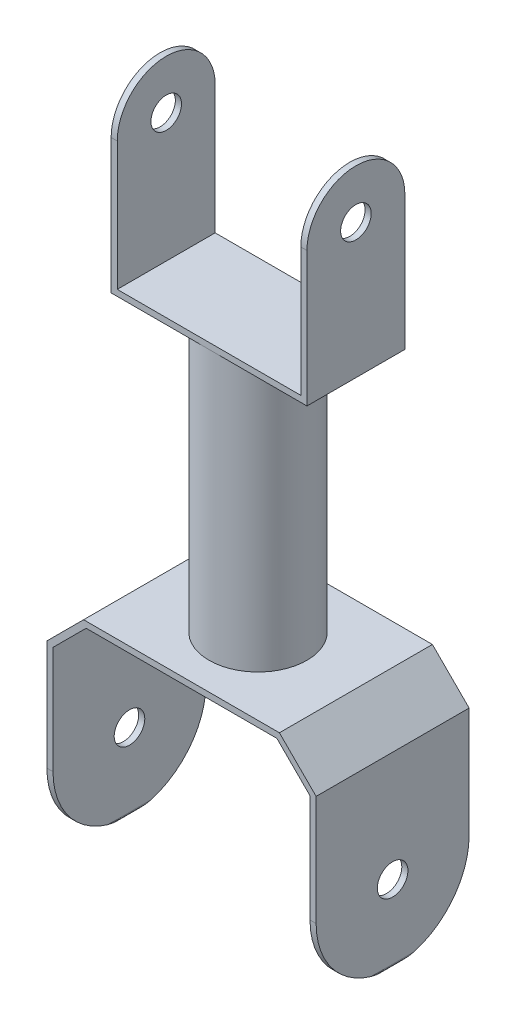
from build123d import *

# Parameters (mm, degrees)
BOSS_EXTRUDE1_DEPTH     = 12.5
BOSS_EXTRUDE1_2_DEPTH   = 12.5
CUT_EXTRUDE1_DEPTH      = 120.593059999
CUT_EXTRUDE1_DEPTH_BACK = 120.593059999
SKETCH3_R               = 2.5
SKETCH4_R               = 8
SKETCH4_R_2             = 6.000365116
BOSS_EXTRUDE2_DEPTH     = 44


with BuildPart() as part:
    # Sketch1 → Boss-Extrude1 (new, symmetric)
    with BuildSketch(Plane.XY):
        with BuildLine():
            Line((-16, 110), (-16, 80))
            Line((-16, 80), (16, 80))
            Line((16, 80), (16, 110))
            ThreePointArc((16, 110), (15.5, 110.5), (15, 110))
            Line((15, 110), (15, 81))
            Line((15, 81), (-15, 81))
            Line((-15, 81), (-15, 110))
            ThreePointArc((-15, 110), (-15.5, 110.5), (-16, 110))
        make_face()
    extrude(amount=BOSS_EXTRUDE1_DEPTH, both=True)


with BuildPart() as body_2:
    # Sketch1 → Boss-Extrude1 2 (new, symmetric)
    with BuildSketch(Plane.XY):
        with BuildLine():
            Line((-22, 0), (-22, 30))
            Line((-22, 30), (-16, 36))
            Line((-16, 36), (16, 36))
            Line((16, 36), (22, 30))
            Line((22, 30), (22, 0))
            ThreePointArc((22, 0), (21.5, -0.5), (21, 0))
            Line((21, 0), (21, 29.585786438))
            Line((21, 29.585786438), (15.585786438, 35))
            Line((15.585786438, 35), (-15.585786438, 35))
            Line((-15.585786438, 35), (-21, 29.585786438))
            Line((-21, 29.585786438), (-21, 0))
            ThreePointArc((-21, 0), (-21.5, -0.5), (-22, 0))
        make_face()
    extrude(amount=BOSS_EXTRUDE1_2_DEPTH, both=True)


with BuildPart() as cut_extrude1_tool:
    # Sketch3 → Cut-Extrude1 (new, two sides: drawn at the far end of the back side and taken through both)
    with BuildSketch(Plane(origin=(22, 0, 0), x_dir=(0, 0, -1), z_dir=(1, 0, 0)).offset(-CUT_EXTRUDE1_DEPTH_BACK)):
        with Locations(Location((0, 102, 0), (0, 0, 90))):
            Circle(SKETCH3_R)
        with Locations((0, 12)):
            Circle(SKETCH3_R)
        with BuildLine():
            Line((8, 80), (8, 102))
            ThreePointArc((8, 102), (0, 110), (-8, 102))
            Line((-8, 102), (-8, 80))
            Line((-8, 80), (-12.5, 80))
            Line((-12.5, 80), (-12.5, 110.5))
            Line((-12.5, 110.5), (12.5, 110.5))
            Line((12.5, 110.5), (12.5, 80))
            Line((12.5, 80), (8, 80))
        make_face()
        with BuildLine():
            Line((-12.5, 12), (-12.5, 36))
            Line((-12.5, 36), (-17.5, 36))
            Line((-17.5, 36), (-17.5, -4))
            Line((-17.5, -4), (17.5, -4))
            Line((17.5, -4), (17.5, 36))
            Line((17.5, 36), (12.5, 36))
            Line((12.5, 36), (12.5, 12))
            ThreePointArc((12.5, 12), (0, -0.5), (-12.5, 12))
        make_face()
    extrude(amount=CUT_EXTRUDE1_DEPTH + CUT_EXTRUDE1_DEPTH_BACK)


with BuildPart() as part_1:
    add(part.part)

    # Cut-Extrude1: cut by cut_extrude1_tool
    add(cut_extrude1_tool.part, mode=Mode.SUBTRACT)



with BuildPart() as body_2_1:
    add(body_2.part)

    # Cut-Extrude1: cut by cut_extrude1_tool
    add(cut_extrude1_tool.part, mode=Mode.SUBTRACT)


with BuildPart() as part_2:
    add(part_1.part)

    add(body_2_1.part)  # Boss-Extrude2 merges body 2
    # Sketch4 → Boss-Extrude2 (add)
    with BuildSketch(Plane(origin=(0, 36, 0), x_dir=(1, 0, 0), z_dir=(0, 1, 0))):
        with Locations(Location((0, 0, 0), (0, 0, 270))):
            Circle(SKETCH4_R)
        with Locations(Location((0, 0, 0), (0, 0, 270))):
            Circle(SKETCH4_R_2, mode=Mode.SUBTRACT)
    extrude(amount=BOSS_EXTRUDE2_DEPTH)


solid = part_2.part
